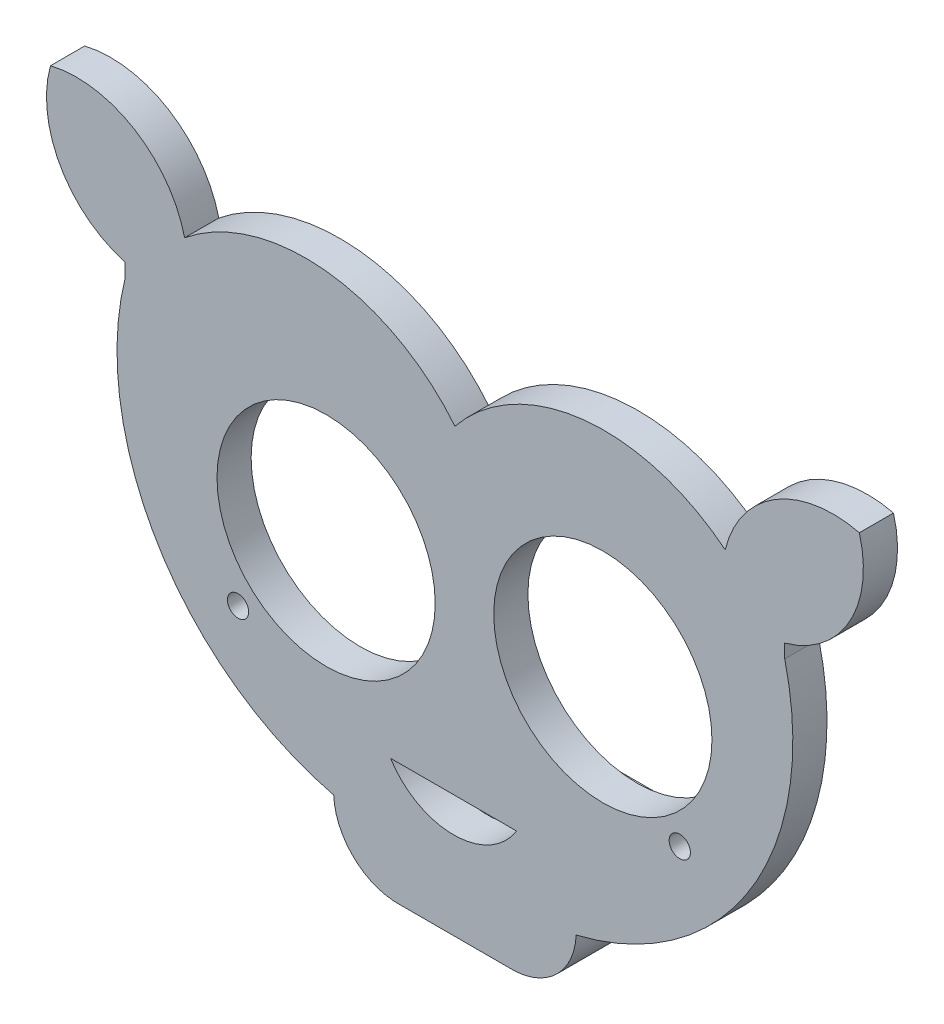
from build123d import *

# Parameters (mm, degrees)
BOSS_EXTRUDE2_DEPTH     = 15
SKETCH4_R               = 10.25
CUT_EXTRUDE1_DEPTH      = 39
SKETCH5_R               = 1
CUT_EXTRUDE2_DEPTH      = 46
CUT_EXTRUDE4_DEPTH      = 30
CUT_EXTRUDE4_DEPTH_BACK = 20
SKETCH8_W               = 87.305200023
SKETCH8_H               = 11.791688203
SKETCH9_R               = 1.5
CUT_EXTRUDE5_DEPTH      = 45


with BuildPart() as part:
    # Sketch2 → Boss-Extrude2 (new body)
    with BuildSketch(Plane.XY):
        with BuildLine():
            Line((29.39514737, -26.166473039), (19.28603361, -26.166473039))
            ThreePointArc((19.28603361, -26.166473039), (14.916401147, -24.5745939), (12.952232935, -20.359168619))
            ThreePointArc((12.952232935, -20.359168619), (-3.527212702, -8.286066454), (-6.642968051, 11.903633717))
            Line((-6.642968051, 11.903633717), (-6.642968051, 13.194145811))
            ThreePointArc((-6.642968051, 13.194145811), (-12.734188373, 17.984078311), (-13.654337816, 25.678215258))
            ThreePointArc((-13.654337816, 25.678215258), (-5.75878812, 24.441537952), (-1.050254298, 17.984078311))
            ThreePointArc((-1.050254298, 17.984078311), (12.191739255, 21.923154941), (24.34059049, 15.3449993))
            ThreePointArc((24.34059049, 15.3449993), (36.489441725, 21.923154941), (49.731435279, 17.984078311))
            ThreePointArc((49.731435279, 17.984078311), (54.439969101, 24.441537952), (62.335518797, 25.678215258))
            ThreePointArc((62.335518797, 25.678215258), (61.415369354, 17.984078311), (55.324149032, 13.194145811))
            Line((55.324149032, 13.194145811), (55.324149032, 11.903633717))
            ThreePointArc((55.324149032, 11.903633717), (52.208393682, -8.286066454), (35.728948045, -20.359168619))
            ThreePointArc((35.728948045, -20.359168619), (33.764779834, -24.5745939), (29.39514737, -26.166473039))
        make_face()
    extrude(amount=BOSS_EXTRUDE2_DEPTH)

    # Sketch4 → Cut-Extrude1 (cut)
    with BuildSketch(Plane.XY):
        with Locations((12.237485625, 0)):
            Circle(SKETCH4_R)
        with Locations((38.237485625, 1.902154712)):
            Circle(SKETCH4_R)
        with BuildLine():
            Line((18.291353785, -14.692373008), (30.14458787, -14.692373008))
            ThreePointArc((30.14458787, -14.692373008), (24.217970827, -17.965213498), (18.291353785, -14.692373008))
        make_face()
    extrude(amount=CUT_EXTRUDE1_DEPTH, mode=Mode.SUBTRACT)

    # Sketch5 → Cut-Extrude2 (cut)
    with BuildSketch(Plane.XY):
        with Locations((3.966291552, -9.460600721)):
            Circle(SKETCH5_R)
        with Locations((45.466291552, -8.281636769)):
            Circle(SKETCH5_R)
    extrude(amount=CUT_EXTRUDE2_DEPTH, mode=Mode.SUBTRACT)

    # Sketch8 → Cut-Extrude4 (cut, two sides: drawn at the far end of the back side and taken through both)
    with BuildSketch(Plane(origin=(0, 0, 0), x_dir=(1, 0, 0), z_dir=(0, 1, 0)).offset(-CUT_EXTRUDE4_DEPTH_BACK)):
        with Locations((24.422336933, -5.895844102)):
            Rectangle(SKETCH8_W, SKETCH8_H)
    extrude(amount=CUT_EXTRUDE4_DEPTH + CUT_EXTRUDE4_DEPTH_BACK, mode=Mode.SUBTRACT)

    # Sketch9 → Cut-Extrude5 (cut)
    with BuildSketch(Plane(origin=(0, 0, 0), x_dir=(1, 0, 0), z_dir=(0, 1, 0))):
        with Locations(Location((24.831069142, -5.82419794, 0), (0, 0, 270))):
            Circle(SKETCH9_R)
    extrude(amount=-CUT_EXTRUDE5_DEPTH, mode=Mode.SUBTRACT)


solid = part.part
